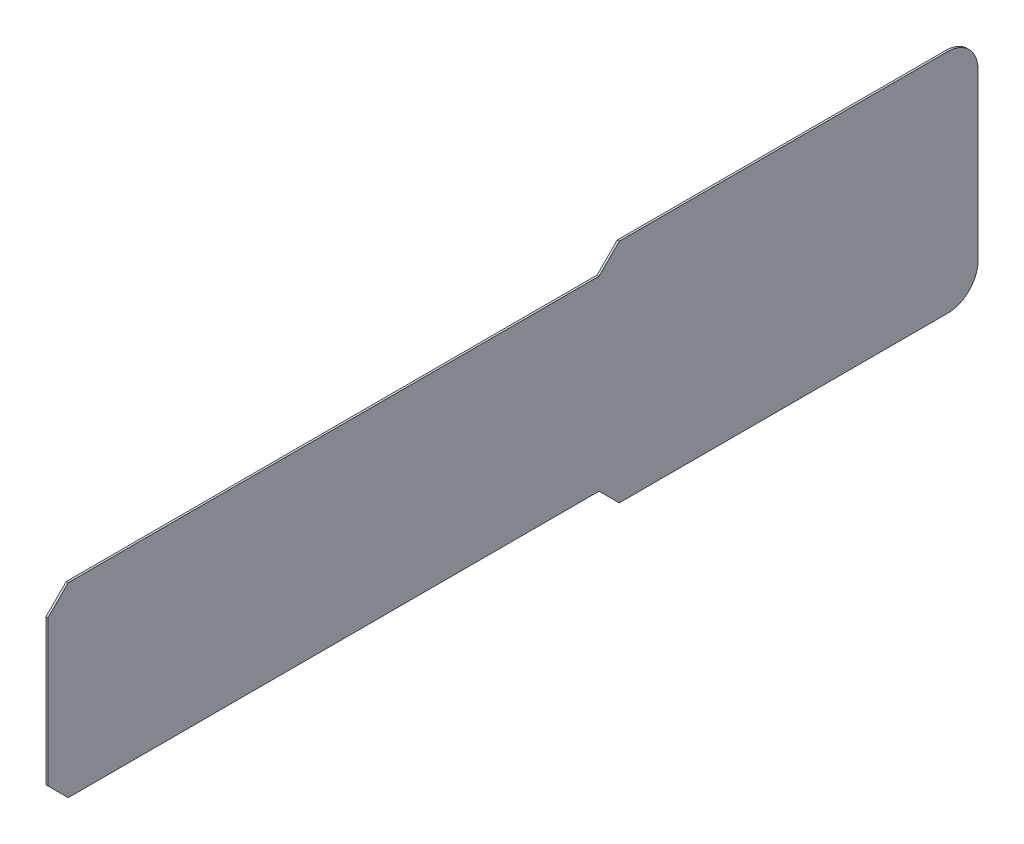
from build123d import *

# Parameters (mm, degrees)
SKETCH2_W           = 22.42
SKETCH2_H           = 92
BOSS_EXTRUDE2_DEPTH = 0.2
FILLET4_R           = 3
FILLET7_R           = 3
SKETCH4_W           = 2
SKETCH4_H           = 54.51
CUT_EXTRUDE1_DEPTH  = 0.2
SKETCH5_W           = 2
SKETCH5_H           = 54.51
CUT_EXTRUDE2_DEPTH  = 0.2
CUT_EXTRUDE3_DEPTH  = 0.2
CUT_EXTRUDE4_DEPTH  = 0.2
CUT_EXTRUDE7_DEPTH  = 0.2
CUT_EXTRUDE8_DEPTH  = 0.2


with BuildPart() as part:
    # Sketch2 → Boss-Extrude2 (new body)
    with BuildSketch(Plane(origin=(0, 0, 0), x_dir=(0, 1, 0), z_dir=(-1, 0, 0))):
        with Locations((-43.813076923, -17.338461538)):
            Rectangle(SKETCH2_W, SKETCH2_H)
    extrude(amount=BOSS_EXTRUDE2_DEPTH)

    # Fillet4
    fillet4_edges = [part.edges().sort_by_distance(p)[0] for p in [
        (-0.1, -55.023076923, -28.661538462),
    ]]
    fillet(fillet4_edges, radius=FILLET4_R)

    # Fillet7
    fillet7_edges = [part.edges().sort_by_distance(p)[0] for p in [
        (-0.1, -32.603076923, -28.661538462),
    ]]
    fillet(fillet7_edges, radius=FILLET7_R)

    # Sketch4 → Cut-Extrude1 (cut)
    with BuildSketch(Plane(origin=(-0.2, 0, 0), x_dir=(0, 1, 0), z_dir=(-1, 0, 0))):
        with Locations((-54.023076923, -36.083461538)):
            Rectangle(SKETCH4_W, SKETCH4_H)
    extrude(amount=-CUT_EXTRUDE1_DEPTH, mode=Mode.SUBTRACT)

    # Sketch5 → Cut-Extrude2 (cut)
    with BuildSketch(Plane(origin=(-0.2, 0, 0), x_dir=(0, 1, 0), z_dir=(-1, 0, 0))):
        with Locations((-33.603076923, -36.083461538)):
            Rectangle(SKETCH5_W, SKETCH5_H)
    extrude(amount=-CUT_EXTRUDE2_DEPTH, mode=Mode.SUBTRACT)

    # Sketch6 → Cut-Extrude3 (cut)
    with BuildSketch(Plane(origin=(-0.2, 0, 0), x_dir=(0, 1, 0), z_dir=(-1, 0, 0))):
        Polygon((-53.023076923, -63.338461538), (-53.023076923, -61.338461538), (-51.023076923, -63.338461538), align=None)
    extrude(amount=-CUT_EXTRUDE3_DEPTH, mode=Mode.SUBTRACT)

    # Sketch7 → Cut-Extrude4 (cut)
    with BuildSketch(Plane(origin=(-0.2, 0, 0), x_dir=(0, 1, 0), z_dir=(-1, 0, 0))):
        Polygon((-34.603076923, -63.338461538), (-34.603076923, -61.338461538), (-36.603076923, -63.338461538), align=None)
    extrude(amount=-CUT_EXTRUDE4_DEPTH, mode=Mode.SUBTRACT)

    # Sketch8 → Cut-Extrude7 (cut)
    with BuildSketch(Plane(origin=(-0.2, 0, 0), x_dir=(0, 1, 0), z_dir=(-1, 0, 0))):
        Polygon((-53.023076923, -8.828461538), (-55.023076923, -8.828461538), (-55.023076923, -6.828461538), align=None)
    extrude(amount=-CUT_EXTRUDE7_DEPTH, mode=Mode.SUBTRACT)

    # Sketch9 → Cut-Extrude8 (cut)
    with BuildSketch(Plane(origin=(-0.2, 0, 0), x_dir=(0, 1, 0), z_dir=(-1, 0, 0))):
        Polygon((-34.603076923, -8.828461538), (-32.603076923, -8.828461538), (-32.603076923, -6.828461538), align=None)
    extrude(amount=-CUT_EXTRUDE8_DEPTH, mode=Mode.SUBTRACT)


solid = part.part
